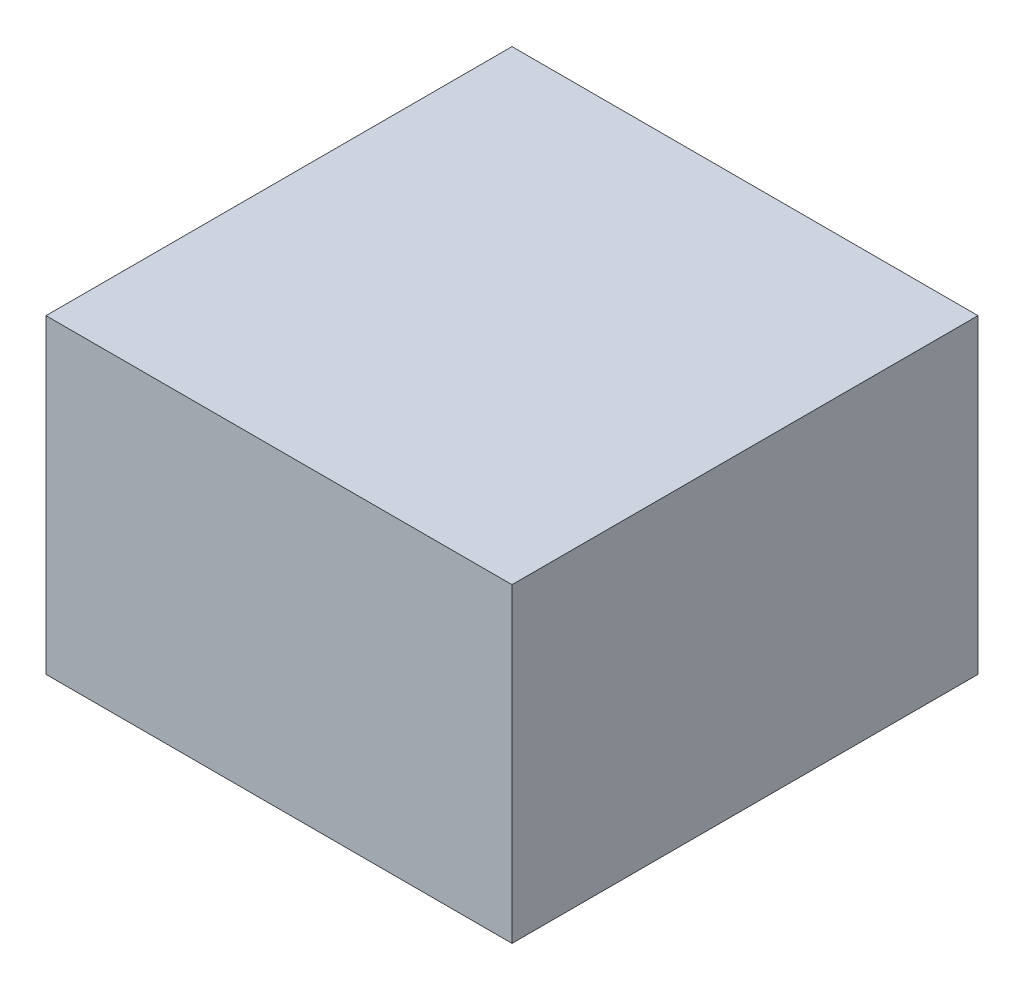
from build123d import *

# Parameters (mm, degrees)
CROQUIS1_W              = 15
CROQUIS1_H              = 15
SALIENTE_EXTRUIR1_DEPTH = 10


with BuildPart() as part:
    # Croquis1 → Saliente-Extruir1 (new body)
    with BuildSketch(Plane(origin=(0, 0, 0), x_dir=(1, 0, 0), z_dir=(0, 1, 0))):
        Rectangle(CROQUIS1_W, CROQUIS1_H)
    extrude(amount=SALIENTE_EXTRUIR1_DEPTH)


solid = part.part
